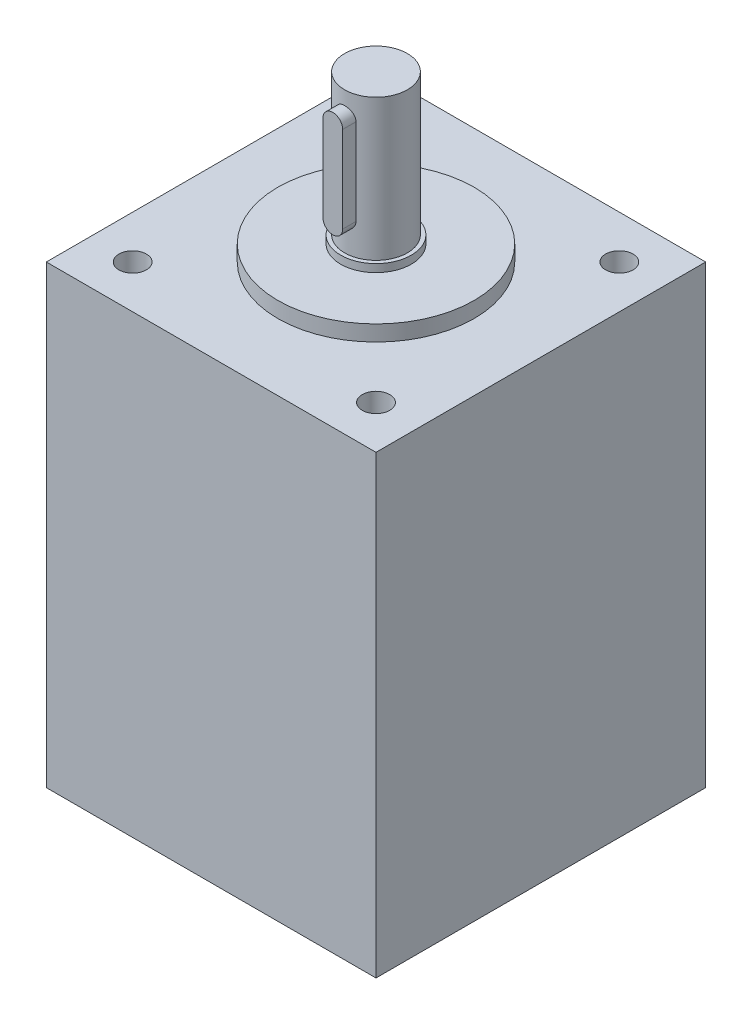
from build123d import *

# Parameters (mm, degrees)
SKETCH_2_W           = 42
SKETCH_2_H           = 42
EXTRUDE_1_DEPTH      = 58
SKETCH_3_R           = 12.5
EXTRUDE_2_DEPTH      = 2
SKETCH_4_R           = 4.5
EXTRUDE_3_DEPTH      = 1
SKETCH_5_R           = 4
EXTRUDE_4_DEPTH      = 18
EXTRUDE_5_DEPTH      = 1.5
EXTRUDE_5_DEPTH_BACK = 4
SKETCH_7_R           = 1.75
CUT_EXTRUDE_1_DEPTH  = 71.5


with BuildPart() as part:
    # 草图2 → 凸台-拉伸1 (new body)
    with BuildSketch(Plane(origin=(0, 0, 0), x_dir=(1, 0, 0), z_dir=(0, 1, 0))):
        with Locations((21, 21)):
            Rectangle(SKETCH_2_W, SKETCH_2_H)
    extrude(amount=EXTRUDE_1_DEPTH)

    # 草图3 → 凸台-拉伸2 (add)
    with BuildSketch(Plane(origin=(0, 58, 0), x_dir=(1, 0, 0), z_dir=(0, 1, 0))):
        with Locations(Location((21, 21, 0), (0, 0, 270))):
            Circle(SKETCH_3_R)
    extrude(amount=EXTRUDE_2_DEPTH)

    # 草图4 → 凸台-拉伸3 (add)
    with BuildSketch(Plane(origin=(0, 60, 0), x_dir=(1, 0, 0), z_dir=(0, 1, 0))):
        with Locations(Location((21, 21, 0), (0, 0, 270))):
            Circle(SKETCH_4_R)
    extrude(amount=EXTRUDE_3_DEPTH)

    # 草图5 → 凸台-拉伸4 (add)
    with BuildSketch(Plane(origin=(0, 61, 0), x_dir=(1, 0, 0), z_dir=(0, 1, 0))):
        with Locations(Location((21, 21, 0), (0, 0, 270))):
            Circle(SKETCH_5_R)
    extrude(amount=EXTRUDE_4_DEPTH)

    # 草图6 → 凸台-拉伸5 (add, two sides: drawn at the far end of the back side and taken through both)
    with BuildSketch(Plane.XY.offset(-17).offset(-EXTRUDE_5_DEPTH_BACK)):
        with BuildLine():
            Line((22.254851431, 76), (22.254851431, 65))
            ThreePointArc((22.254851431, 65), (21, 63.745148569), (19.745148569, 65))
            Line((19.745148569, 65), (19.745148569, 76))
            ThreePointArc((19.745148569, 76), (21, 77.254851431), (22.254851431, 76))
        make_face()
    extrude(amount=EXTRUDE_5_DEPTH + EXTRUDE_5_DEPTH_BACK)

    # 草图7 → 切除-拉伸1 (cut)
    with BuildSketch(Plane(origin=(0, 58, 0), x_dir=(1, 0, 0), z_dir=(0, 1, 0))):
        with Locations(Location((5.5, 36.5, 0), (0, 0, 270))):
            Circle(SKETCH_7_R)
        with Locations(Location((36.5, 36.5, 0), (0, 0, 90))):
            Circle(SKETCH_7_R)
        with Locations(Location((36.5, 5.5, 0), (0, 0, 270))):
            Circle(SKETCH_7_R)
        with Locations(Location((5.5, 5.5, 0), (0, 0, 90))):
            Circle(SKETCH_7_R)
    extrude(amount=-CUT_EXTRUDE_1_DEPTH, mode=Mode.SUBTRACT)


solid = part.part
